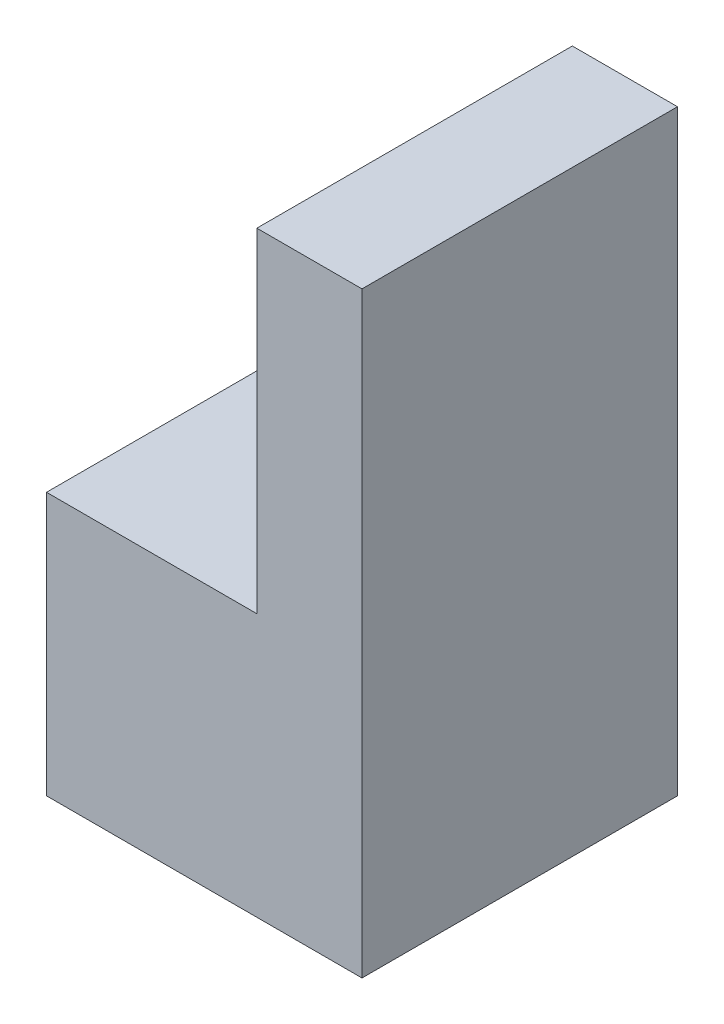
from build123d import *

# Parameters (mm, degrees)
SKETCH1_W           = 24
SKETCH1_H           = 24
BOSS_EXTRUDE1_DEPTH = 20
SKETCH2_W           = 8
SKETCH2_H           = 24
BOSS_EXTRUDE2_DEPTH = 25.4
SKETCH3_R           = 1.65
CUT_EXTRUDE1_DEPTH  = 15


with BuildPart() as part:
    # Sketch1 → Boss-Extrude1 (new body)
    with BuildSketch(Plane(origin=(0, 0, 0), x_dir=(1, 0, 0), z_dir=(0, 1, 0))):
        with Locations((12, 12)):
            Rectangle(SKETCH1_W, SKETCH1_H)
    extrude(amount=BOSS_EXTRUDE1_DEPTH)

    # Sketch2 → Boss-Extrude2 (add)
    with BuildSketch(Plane(origin=(0, 20, 0), x_dir=(1, 0, 0), z_dir=(0, 1, 0))):
        with Locations((20, 12)):
            Rectangle(SKETCH2_W, SKETCH2_H)
    extrude(amount=BOSS_EXTRUDE2_DEPTH)

    # Sketch3 → Cut-Extrude1 (cut)
    with BuildSketch(Plane(origin=(0, 0, 0), x_dir=(-1, 0, 0), z_dir=(0, -1, 0))):
        with Locations(Location((-4, 16, 0), (0, 0, 90))):
            Circle(SKETCH3_R)
        with Locations(Location((-4, 8, 0), (0, 0, 90))):
            Circle(SKETCH3_R)
        with Locations(Location((-12, 8, 0), (0, 0, 90))):
            Circle(SKETCH3_R)
        with Locations(Location((-12, 16, 0), (0, 0, 90))):
            Circle(SKETCH3_R)
        with Locations(Location((-20, 8, 0), (0, 0, 90))):
            Circle(SKETCH3_R)
        with Locations(Location((-20, 16, 0), (0, 0, 90))):
            Circle(SKETCH3_R)
    extrude(amount=-CUT_EXTRUDE1_DEPTH, mode=Mode.SUBTRACT)


solid = part.part
